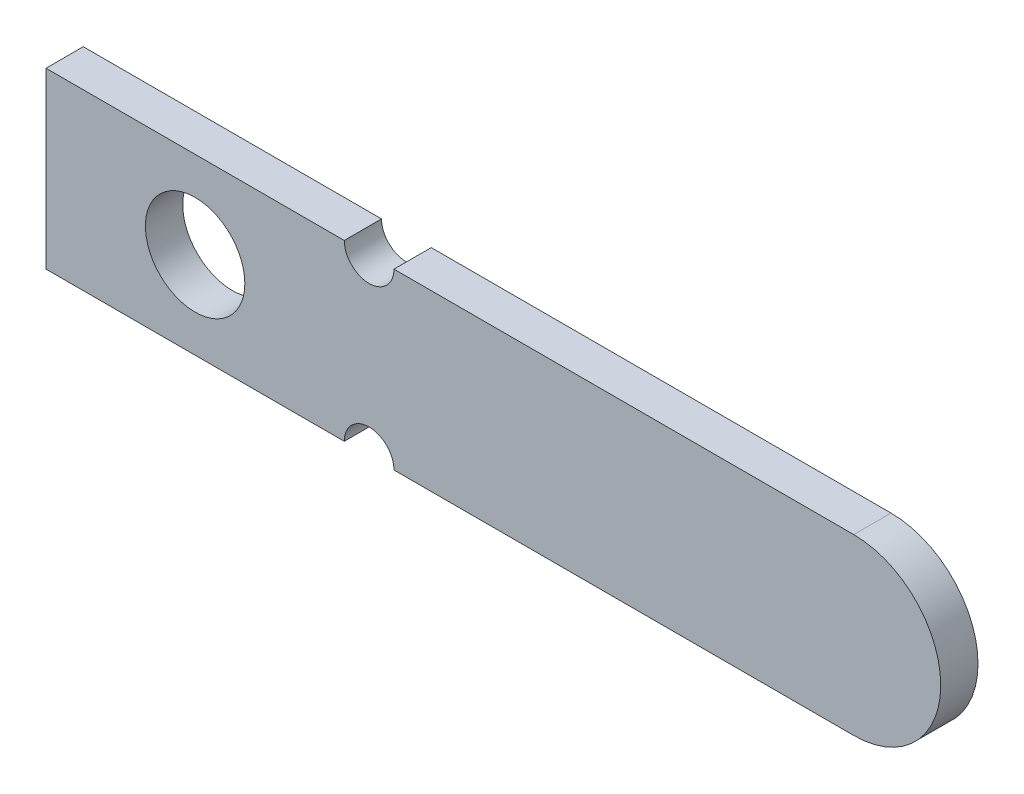
from build123d import *

# Parameters (mm, degrees)
SKETCH1_R           = 2
BOSS_EXTRUDE1_DEPTH = 1.5


with BuildPart() as part:
    # Sketch1 → Boss-Extrude1 (new body)
    with BuildSketch(Plane.XY):
        with BuildLine():
            Line((-16.25, 3.5), (-4.25, 3.5))
            ThreePointArc((-4.25, 3.5), (-3.25, 2.5), (-2.25, 3.5))
            Line((-2.25, 3.5), (16.25, 3.5))
            ThreePointArc((16.25, 3.5), (19.75, 0), (16.25, -3.5))
            Line((16.25, -3.5), (-2.25, -3.5))
            ThreePointArc((-2.25, -3.5), (-3.25, -2.5), (-4.25, -3.5))
            Line((-4.25, -3.5), (-16.25, -3.5))
            Line((-16.25, -3.5), (-16.25, 3.5))
        make_face()
        with Locations((-10.25, 0)):
            Circle(SKETCH1_R, mode=Mode.SUBTRACT)
    extrude(amount=BOSS_EXTRUDE1_DEPTH)


solid = part.part
